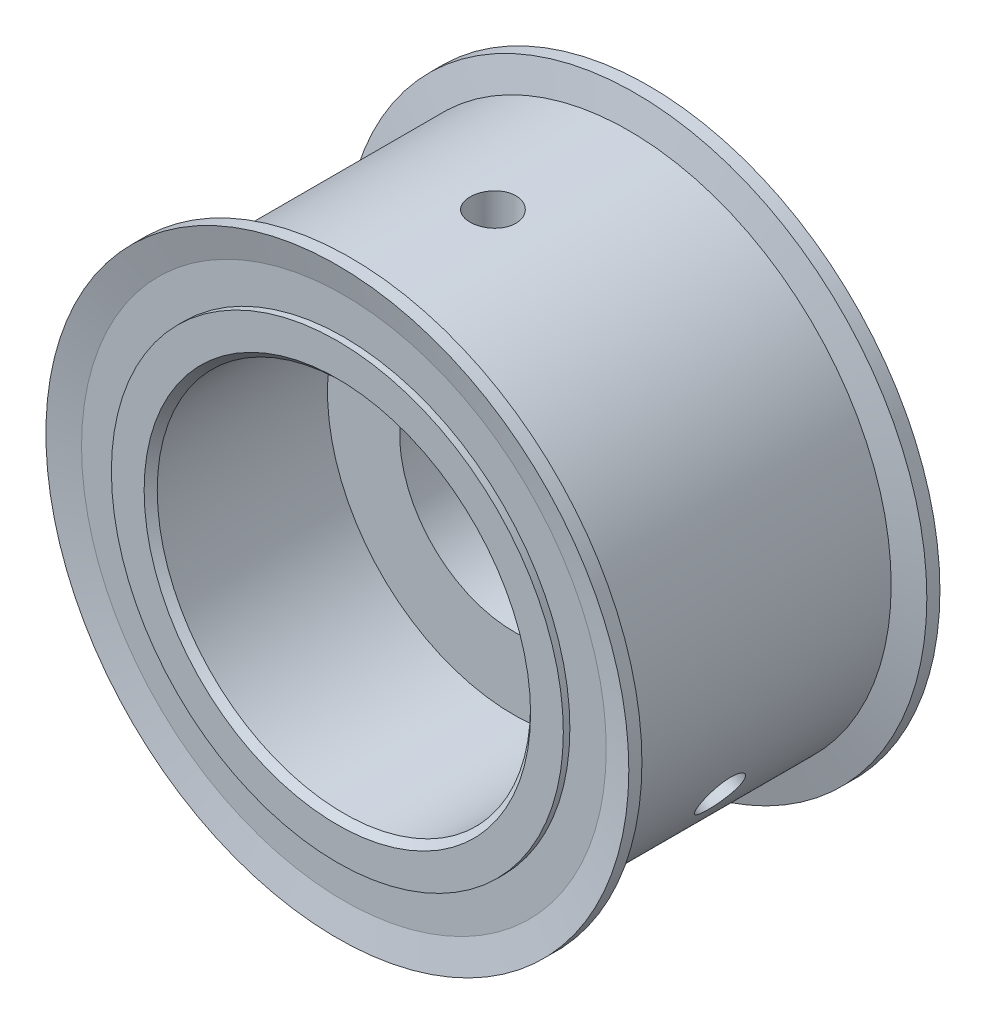
from build123d import *

# Parameters (mm, degrees)
F_7_0_7_DIAMETER_HOLE1_D     = 7
F_7_0_7_DIAMETER_HOLE1_DEPTH = 10
M6X1_0_TAPPED_HOLE1_REACH    = 100.969
M6X1_0_TAPPED_HOLE1_BORE_R   = 2.5
CIRPATTERN1_COUNT            = 2
CIRPATTERN1_ANGLE            = 120
CHAMFER1_SIZE                = 1


with BuildPart() as part:
    # Sketch1 → Revolve1 (revolve)
    with BuildSketch(Plane(origin=(0, 0, 0), x_dir=(0, 0, -1), z_dir=(1, 0, 0)), mode=Mode.PRIVATE) as revolve1_sk:
        Polygon((-47.5, 34.5), (-46.5, 34.5), (-46.5, 40.055), (-47.5, 44.5), (-45.5, 44.5), (-44.5, 40.055), (-3, 40.055), (-2, 44.5), (0, 44.5), (-1, 40.055), (-1, 34.5), (0, 34.5), (0, 0), (-47.5, 0), align=None)
    revolve(revolve1_sk.sketch.rotate(Axis((0, 0, 58.930723614), (0, 0, -1)), 90), axis=Axis((0, 0, 58.930723614), (0, 0, -1)))

    # Sketch2 → Cut-Revolve1 (revolve, cut)
    with BuildSketch(Plane(origin=(0, 0, 0), x_dir=(0, 0, -1), z_dir=(1, 0, 0)), mode=Mode.PRIVATE) as cut_revolve1_sk:
        Polygon((-20.5, 17.5), (0, 17.5), (0, 0), (-47.5, 0), (-47.5, 28.5), (-20.5, 28.5), align=None)
    revolve(cut_revolve1_sk.sketch.rotate(Axis((0, 0, 2.983613524), (0, 0, -1)), 90), axis=Axis((0, 0, 2.983613524), (0, 0, -1)), mode=Mode.SUBTRACT)

    # Ø7.0 (7) Diameter Hole1
    with Locations(Plane(origin=(0, 40.055, 0), x_dir=(-1, 0, 0), z_dir=(0, 1, 0))):
        with Locations((0, 23.75)):
            f_7_0_7_diameter_hole1 = Hole(F_7_0_7_DIAMETER_HOLE1_D / 2, depth=F_7_0_7_DIAMETER_HOLE1_DEPTH)

    # M6x1.0 Tapped Hole1 bore → M6x1.0 Tapped Hole1 (cut, up to next)
    with BuildSketch(Plane(origin=(0, 30.055, 0), x_dir=(-1, 0, 0), z_dir=(0, 1, 0)), mode=Mode.PRIVATE) as m6x1_0_tapped_hole1_sk1:
        with Locations((0, 23.75)):
            Circle(M6X1_0_TAPPED_HOLE1_BORE_R)
    m6x1_0_tapped_hole1_tool1 = extrude(m6x1_0_tapped_hole1_sk1.sketch, amount=-M6X1_0_TAPPED_HOLE1_REACH, mode=Mode.PRIVATE) & part.part
    m6x1_0_tapped_hole1 = m6x1_0_tapped_hole1_tool1.solids().sort_by_distance((0, 30.055, 23.75))[0]
    add(m6x1_0_tapped_hole1, mode=Mode.SUBTRACT)

    # CirPattern1: Ø7.0 (7) Diameter Hole1, M6x1.0 Tapped Hole1 ×2 about axis
    cirpattern1_axis = Axis((0, 0, 2.983613524), (0, 0, -1))
    add([f_7_0_7_diameter_hole1.rotate(cirpattern1_axis, i * CIRPATTERN1_ANGLE / (CIRPATTERN1_COUNT - 1)) for i in range(1, CIRPATTERN1_COUNT)], mode=Mode.SUBTRACT)
    add([m6x1_0_tapped_hole1.rotate(cirpattern1_axis, i * CIRPATTERN1_ANGLE / (CIRPATTERN1_COUNT - 1)) for i in range(1, CIRPATTERN1_COUNT)], mode=Mode.SUBTRACT)

    # Chamfer1
    chamfer1_edges = [part.edges().sort_by_distance(p)[0] for p in [
        (-28.5, 0, 47.5),
    ]]
    chamfer(chamfer1_edges, length=CHAMFER1_SIZE)


solid = part.part
